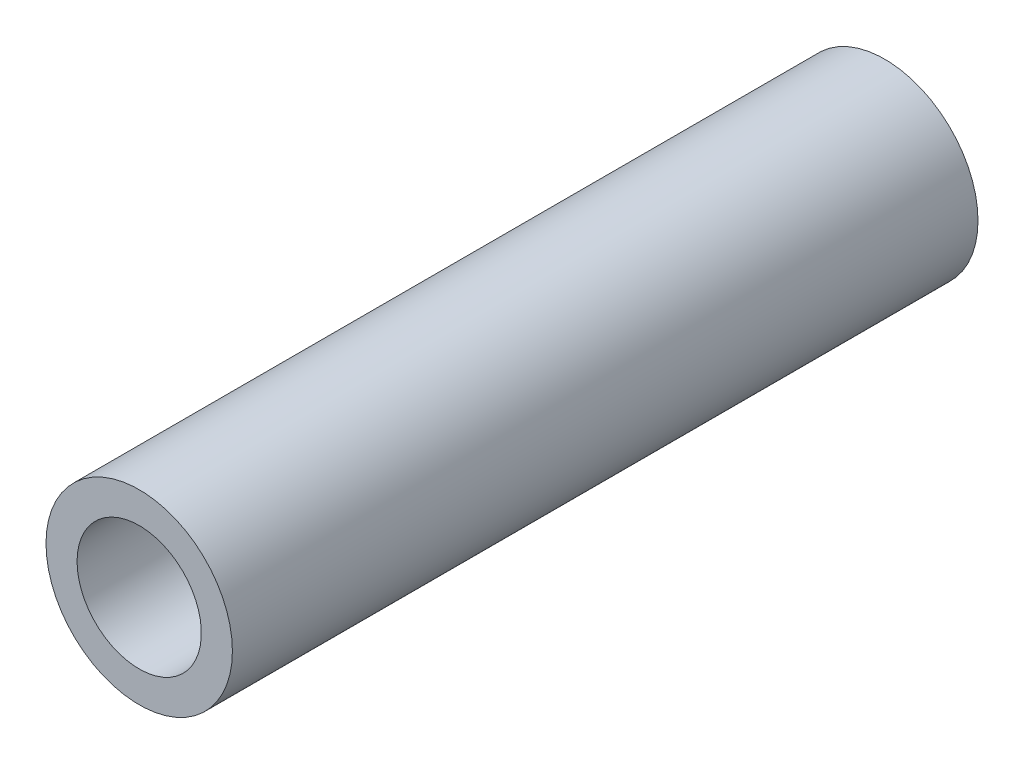
from build123d import *

# Parameters (mm, degrees)
SKETCH1_R           = 2.38125
SKETCH1_R_2         = 1.5875
BOSS_EXTRUDE1_DEPTH = 19.05


with BuildPart() as part:
    # Sketch1 → Boss-Extrude1 (new body)
    with BuildSketch(Plane.XY):
        with Locations(Location((0, 0, 0), (0, 0, 180))):
            Circle(SKETCH1_R)
        with Locations(Location((0, 0, 0), (0, 0, 180))):
            Circle(SKETCH1_R_2, mode=Mode.SUBTRACT)
    extrude(amount=BOSS_EXTRUDE1_DEPTH)


solid = part.part
